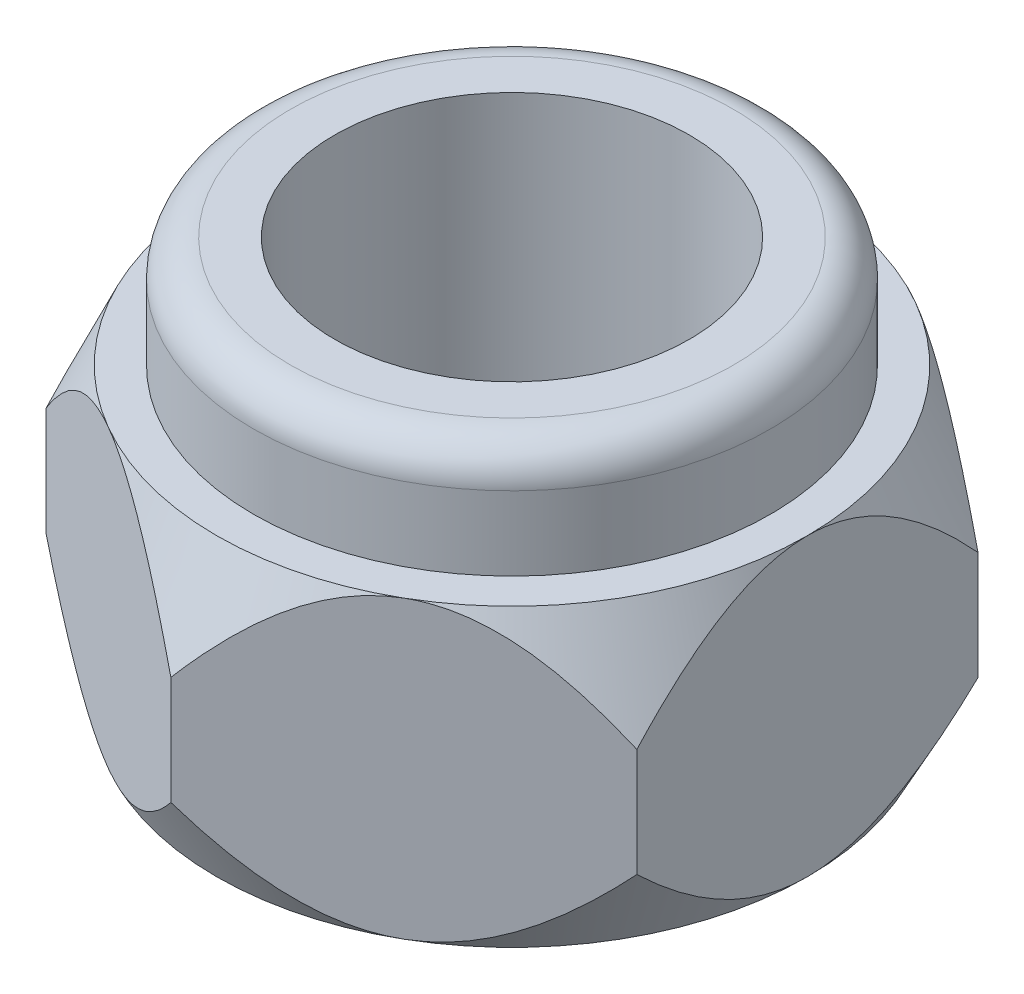
from build123d import *

# Parameters (mm, degrees)
EXTRUDE_1_DEPTH     = 4
SKETCH_2_R          = 3.5
EXTRUDE_2_DEPTH     = 1.5
FILLET_1_R          = 0.5
SKETCH_3_R          = 2.4
CUT_EXTRUDE_1_DEPTH = 9.220908303


with BuildPart() as part:
    # 草图1 → 凸台-拉伸1 (new body)
    with BuildSketch(Plane(origin=(0, 0, 0), x_dir=(1, 0, 0), z_dir=(0, 1, 0))):
        Polygon((4, 2.309401077), (0, 4.618802154), (-4, 2.309401077), (-4, -2.309401077), (0, -4.618802154), (4, -2.309401077), align=None)
    extrude(amount=EXTRUDE_1_DEPTH)

    # 草图2 → 凸台-拉伸2 (add)
    with BuildSketch(Plane(origin=(0, 4, 0), x_dir=(1, 0, 0), z_dir=(0, 1, 0))):
        with Locations(Location((0, 0, 0), (0, 0, 270))):
            Circle(SKETCH_2_R)
    extrude(amount=EXTRUDE_2_DEPTH)

    # 圆角1
    fillet_1_edges = [part.edges().sort_by_distance(p)[0] for p in [
        (0, 5.5, -3.5),
    ]]
    fillet(fillet_1_edges, radius=FILLET_1_R)

    # 草图3 → 切除-拉伸1 (cut, through all)
    with BuildSketch(Plane.XZ):
        with Locations(Location((0, 0, 0), (0, 0, 270))):
            Circle(SKETCH_3_R)
    extrude(amount=-CUT_EXTRUDE_1_DEPTH, mode=Mode.SUBTRACT)

    # 草图4 → 切除-旋转1 (revolve, cut)
    with BuildSketch(Plane.XY):
        Polygon((4.708641342, 0), (4.708641342, 1.352262465), (4, 0), align=None)
        Polygon((4, 4), (4.708641342, 4), (4.708641342, 2.451754507), align=None)
    revolve(axis=Axis((0, 0, 0), (0, 1, 0)), mode=Mode.SUBTRACT)


solid = part.part
